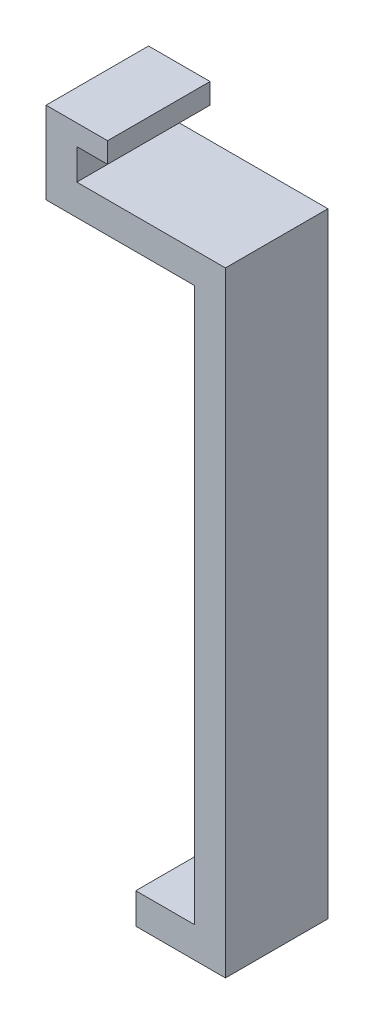
from build123d import *

# Parameters (mm, degrees)
SALIENTE_EXTRUIR2_DEPTH = 10


with BuildPart() as part:
    # Croquis2 → Saliente-Extruir2 (new body)
    with BuildSketch(Plane.XY):
        Polygon((-18.229840155, 32), (-18.229840155, 24), (-3.729840155, 24), (-3.729840155, 0), (-3.729840155, -30), (-9.479840155, -30), (-9.479840155, -33), (-0.729840155, -33), (-0.729840155, 0), (-0.729840155, 27), (-15.229840155, 27), (-15.229840155, 30), (-12.229840155, 30), (-12.229840155, 32), align=None)
    extrude(amount=SALIENTE_EXTRUIR2_DEPTH)


solid = part.part
